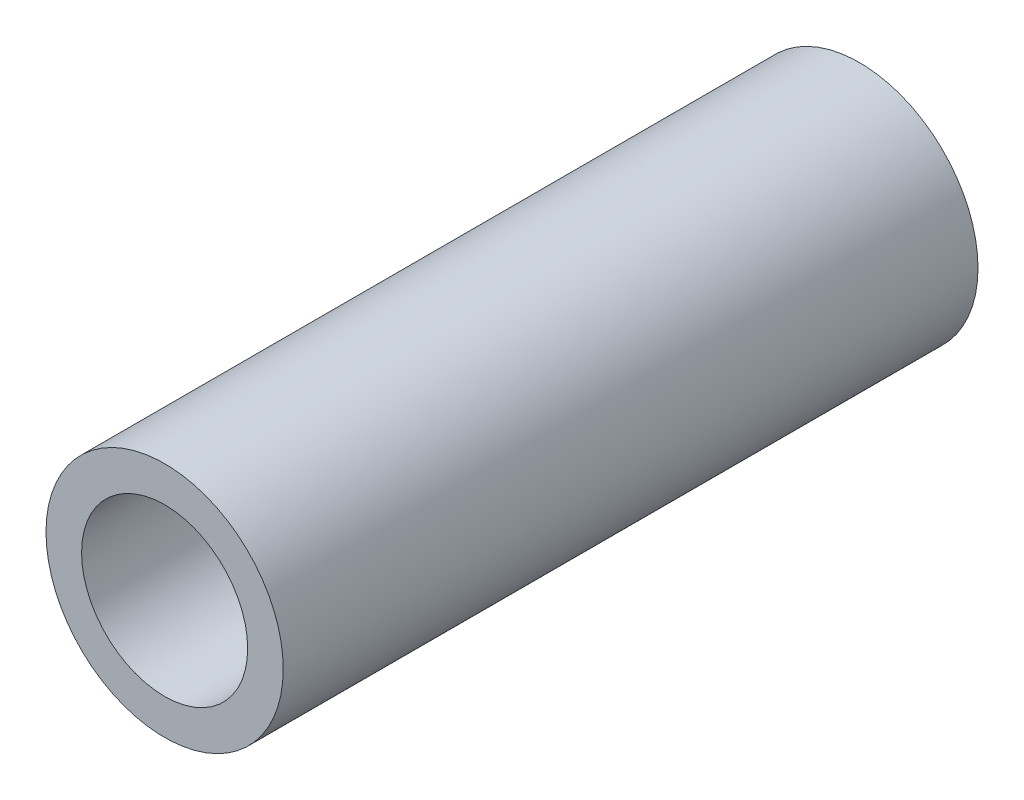
from build123d import *

# Parameters (mm, degrees)
SKETCH1_R           = 1.75
SKETCH1_R_2         = 1.225
BOSS_EXTRUDE1_DEPTH = 10.25


with BuildPart() as part:
    # Sketch1 → Boss-Extrude1 (new body)
    with BuildSketch(Plane.XY):
        Circle(SKETCH1_R)
        Circle(SKETCH1_R_2, mode=Mode.SUBTRACT)
    extrude(amount=BOSS_EXTRUDE1_DEPTH)


solid = part.part
